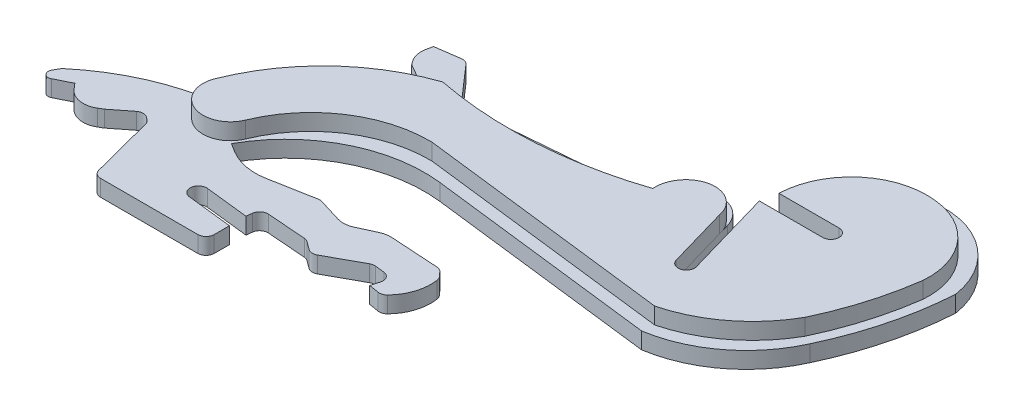
from build123d import *

# Parameters (mm, degrees)
BOSS_EXTRUDE1_DEPTH = 3
FILLET1_R           = 10
FILLET2_R           = 1
FILLET3_R           = 1.5
FILLET4_R           = 4
FILLET5_R           = 4
BOSS_EXTRUDE2_DEPTH = 3


with BuildPart() as part:
    # Sketch2 → Boss-Extrude1 (new body)
    with BuildSketch(Plane(origin=(0, 0, 0), x_dir=(1, 0, 0), z_dir=(0, 1, 0))):
        with BuildLine():
            Line((-42.5, 9.815250458), (-40.2, 13.848552856))
            ThreePointArc((-40.2, 13.848552856), (-31.616402931, 19.380516515), (-21.88, 22.46))
            ThreePointArc((-21.88, 22.46), (-15.087159026, 34.642704233), (-4.89, 44.16))
            Line((-4.89, 44.16), (-8.851038754, 46.435359195))
            Line((-8.851038754, 46.435359195), (-10.31, 48.433697347))
            Line((-10.31, 48.433697347), (-9.719569356, 51.28656851))
            Line((-9.719569356, 51.28656851), (-4.45, 52.03))
            Line((-4.45, 52.03), (2.1, 44.53))
            Line((2.1, 44.53), (35.22, 47.35))
            ThreePointArc((35.22, 47.35), (39.1087714, 53.552611798), (45.450837647, 49.895682508))
            Line((45.450837647, 49.895682508), (49.271682555, 36.649721013))
            ThreePointArc((49.271682555, 36.649721013), (51.113757972, 35.62), (52.162431436, 37.451352279))
            Line((52.162431436, 37.451352279), (49.298477535, 47.38))
            Line((49.298477535, 47.38), (47.49564271, 53.63))
            Line((47.49564271, 53.63), (59.07164271, 53.63))
            ThreePointArc((59.07164271, 53.63), (60.57164271, 55.13), (59.07164271, 56.63))
            Line((59.07164271, 56.63), (48.07164271, 56.63))
            Line((48.07164271, 56.63), (48.010812194, 60.48))
            ThreePointArc((48.010812194, 60.48), (62.895920888, 72.4), (77.21, 59.8))
            ThreePointArc((77.21, 59.8), (75.464062366, 48.951036242), (71.72, 38.62))
            ThreePointArc((71.72, 38.62), (64.699564013, 29.762620869), (54.32, 25.29))
            Line((54.32, 25.29), (12.44, 30.35))
            ThreePointArc((12.44, 30.35), (-2.155765073, 27.757228529), (-12.82, 17.46))
            Line((-12.82, 17.46), (-7.923093172, 14.42))
            Line((-7.923093172, 14.42), (4.26, 16.67))
            Line((4.26, 16.67), (10.264967392, 14.82186735))
            Line((10.264967392, 14.82186735), (15.68118928, 17.321714129))
            Line((15.68118928, 17.321714129), (26.105067381, 16.67))
            Line((26.105067381, 16.67), (27.5, 15.12))
            ThreePointArc((27.5, 15.12), (27.256062178, 10.796585791), (24.812537217, 7.22158903))
            Line((24.812537217, 7.22158903), (22.269740859, 7.646334739))
            Line((22.269740859, 7.646334739), (23.205269456, 10.857431213))
            Line((23.205269456, 10.857431213), (19.255161489, 11.297641869))
            Line((19.255161489, 11.297641869), (11.827625236, 7.22158903))
            Line((11.827625236, 7.22158903), (9.25, 9.1))
            Line((9.25, 9.1), (0.278765895, 9.8))
            Line((0.278765895, 9.8), (0, 7.298571725))
            Line((0, 7.298571725), (-7.923093172, 8.181542538))
            ThreePointArc((-7.923093172, 8.181542538), (-9.58, 6.856906829), (-8.255364291, 5.2))
            Line((-8.255364291, 5.2), (0, 4.28))
            Line((0, 4.28), (0, 0))
            Line((0, 0), (-20.44, 0))
            Line((-20.44, 0), (-23.89, 13.229016126))
            Line((-23.89, 13.229016126), (-25.72, 14.58))
            Line((-25.72, 14.58), (-29.87882635, 11.312892327))
            Line((-29.87882635, 11.312892327), (-33.582044966, 9.115250458))
            Line((-33.582044966, 9.115250458), (-36.680656461, 12.703691255))
            Line((-36.680656461, 12.703691255), (-42.5, 9.815250458))
        make_face()
    extrude(amount=BOSS_EXTRUDE1_DEPTH)

    # Fillet1
    fillet1_edges = [part.edges().sort_by_distance(p)[0] for p in [
        (-7.923093172, 1.5, -14.42),
    ]]
    fillet(fillet1_edges, radius=FILLET1_R)

    # Fillet2
    fillet2_edges = [part.edges().sort_by_distance(p)[0] for p in [
        (-42.5, 1.5, -9.815250458),
    ]]
    fillet(fillet2_edges, radius=FILLET2_R)

    # Fillet3
    fillet3_edges = [part.edges().sort_by_distance(p)[0] for p in [
        (4.26, 1.5, -16.67),
        (26.105067381, 1.5, -16.67),
        (27.5, 1.5, -15.12),
        (24.812537217, 1.5, -7.22158903),
        (23.205269456, 1.5, -10.857431213),
        (19.255161489, 1.5, -11.297641869),
        (11.827625236, 1.5, -7.22158903),
        (9.25, 1.5, -9.1),
        (0.278765895, 1.5, -9.8),
        (0, 1.5, 0),
        (-20.44, 1.5, 0),
        (-23.89, 1.5, -13.229016126),
        (-25.72, 1.5, -14.58),
        (-21.88, 1.5, -22.46),
        (-4.89, 1.5, -44.16),
        (-4.45, 1.5, -52.03),
        (2.1, 1.5, -44.53),
        (35.22, 1.5, -47.35),
    ]]
    fillet(fillet3_edges, radius=FILLET3_R)

    # Fillet4
    fillet4_edges = [part.edges().sort_by_distance(p)[0] for p in [
        (-33.582044966, 1.5, -9.115250458),
        (-10.31, 1.5, -48.433697347),
    ]]
    fillet(fillet4_edges, radius=FILLET4_R)

    # Fillet5
    fillet5_edges = [part.edges().sort_by_distance(p)[0] for p in [
        (10.264967392, 1.5, -14.82186735),
        (15.68118928, 1.5, -17.321714129),
    ]]
    fillet(fillet5_edges, radius=FILLET5_R)


with BuildPart() as body_2:
    # Sketch3 → Boss-Extrude2 (new body)
    with BuildSketch(Plane(origin=(0, 3, 0), x_dir=(1, 0, 0), z_dir=(0, 1, 0))):
        with BuildLine():
            Line((47.49564271, 53.63), (52.162431436, 37.451352279))
            ThreePointArc((52.162431436, 37.451352279), (51.113757972, 35.62), (49.271682555, 36.649721013))
            Line((49.271682555, 36.649721013), (46.060753469, 47.781249263))
            ThreePointArc((46.060753469, 47.781249263), (43.663324393, 51.196046687), (39.509770815, 51.591647872))
            ThreePointArc((39.509770815, 51.591647872), (36.671412252, 49.361522696), (35.789887525, 45.861143889))
            ThreePointArc((35.789887525, 45.861143889), (17.914819637, 42.355240721), (-0.263335901, 43.523174907))
            ThreePointArc((-0.263335901, 43.523174907), (-13.150433821, 35.718829472), (-21.585997074, 23.235786051))
            ThreePointArc((-21.585997074, 23.235786051), (-18.787922166, 16.710792033), (-12.251673396, 19.482474221))
            ThreePointArc((-12.251673396, 19.482474221), (-4.100058768, 29.426278917), (8.244786893, 33.022507287))
            Line((8.244786893, 33.022507287), (54.5778905, 27.4244771))
            ThreePointArc((54.5778905, 27.4244771), (63.558088847, 31.821488993), (70.092790044, 39.389537367))
            ThreePointArc((70.092790044, 39.389537367), (73.196650491, 47.512542622), (75.021833478, 56.014652425))
            ThreePointArc((75.021833478, 56.014652425), (72.143647203, 65.190990417), (63.674821624, 69.748196631))
            ThreePointArc((63.674821624, 69.748196631), (52.973928794, 66.637617234), (48.07164271, 56.63))
            Line((48.07164271, 56.63), (59.07164271, 56.63))
            ThreePointArc((59.07164271, 56.63), (60.57164271, 55.13), (59.07164271, 53.63))
            Line((59.07164271, 53.63), (47.49564271, 53.63))
        make_face()
    extrude(amount=BOSS_EXTRUDE2_DEPTH)


solid = Compound([part.part, body_2.part])
